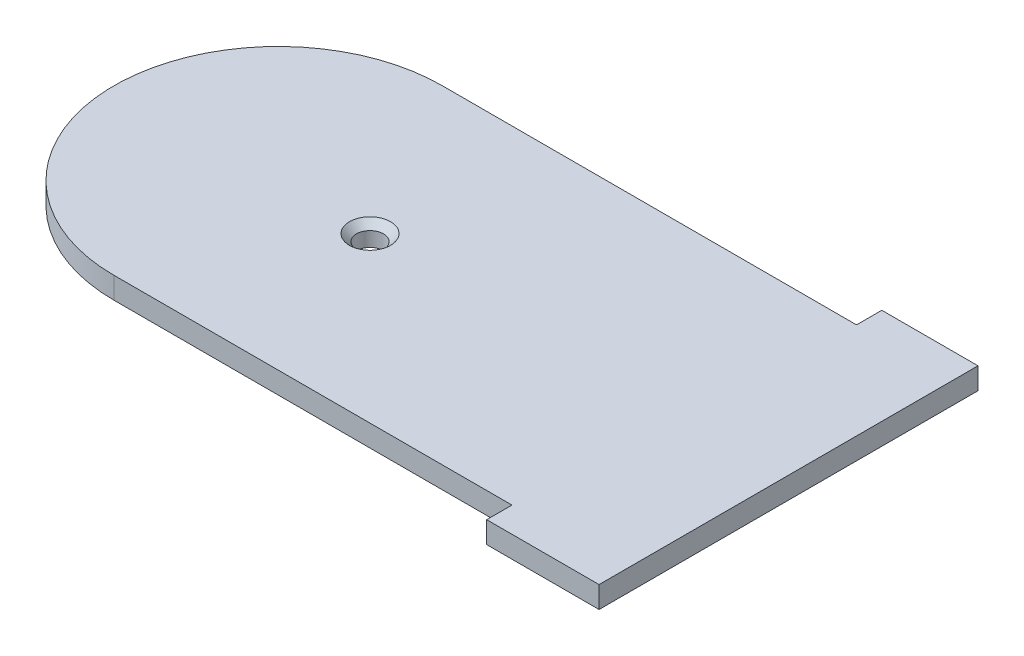
from build123d import *

# Parameters (mm, degrees)
BASE_SHAPE_DEPTH            = 2
SCREW_HOLE_SKETCH_R         = 1.25
SCREW_HOLE_DEPTH            = 51.413108579
PCB_CUTOUT_SKETCH_W         = 9
PCB_CUTOUT_SKETCH_H         = 11
CAMERA_PCB_CUTOUT_DEPTH     = 1.5
CAMERA_RIBBON_ROUTING_DEPTH = 9


with BuildPart() as part:
    # Base Shape Sketch → Base Shape (new body)
    with BuildSketch(Plane(origin=(0, 0, 0), x_dir=(1, 0, 0), z_dir=(0, 1, 0))):
        with BuildLine():
            Line((0, 15.19), (38.325, 15.19))
            Line((38.325, 15.19), (38.325, 17.5294293))
            Line((38.325, 17.5294293), (47.225, 17.5294293))
            Line((47.225, 17.5294293), (47.225, -17.5294293))
            Line((47.225, -17.5294293), (36.825, -17.5294293))
            Line((36.825, -17.5294293), (36.825, -15.19))
            Line((36.825, -15.19), (0, -15.19))
            ThreePointArc((0, -15.19), (-15.19, 0), (0, 15.19))
        make_face()
    extrude(amount=BASE_SHAPE_DEPTH)

    # Screw Hole Sketch → Screw Hole (cut, through all)
    with BuildSketch(Plane(origin=(0, 2, 0), x_dir=(1, 0, 0), z_dir=(0, 1, 0))):
        with Locations(Location((8.5, 0, 0), (0, 0, 270))):
            Circle(SCREW_HOLE_SKETCH_R)
    extrude(amount=-SCREW_HOLE_DEPTH, mode=Mode.SUBTRACT)

    # Countersink Sketch → Screw Hole Countersink (revolve, cut)
    with BuildSketch(Plane.XY, mode=Mode.PRIVATE) as screw_hole_countersink_sk:
        Polygon((8.5, 2), (8.5, 0.8), (9.5, 0.8), (9.5, 1.1), (10.4, 2), align=None)
    revolve(screw_hole_countersink_sk.sketch.rotate(Axis((8.5, 2, 0), (0, -1, 0)), 90), axis=Axis((8.5, 2, 0), (0, -1, 0)), mode=Mode.SUBTRACT)

    # PCB Cutout Sketch → Camera PCB Cutout (cut)
    with BuildSketch(Plane.XZ):
        with Locations((0, -1)):
            Rectangle(PCB_CUTOUT_SKETCH_W, PCB_CUTOUT_SKETCH_H)
    extrude(amount=-CAMERA_PCB_CUTOUT_DEPTH, mode=Mode.SUBTRACT)

    # Ribbon Routing Sketch → Camera Ribbon Routing (cut)
    with BuildSketch(Plane.ZY.offset(-4.5)):
        Polygon((-6.5, 1.5), (-12.098076211, 0), (-6.5, 0), align=None)
    extrude(amount=CAMERA_RIBBON_ROUTING_DEPTH, mode=Mode.SUBTRACT)


solid = part.part
